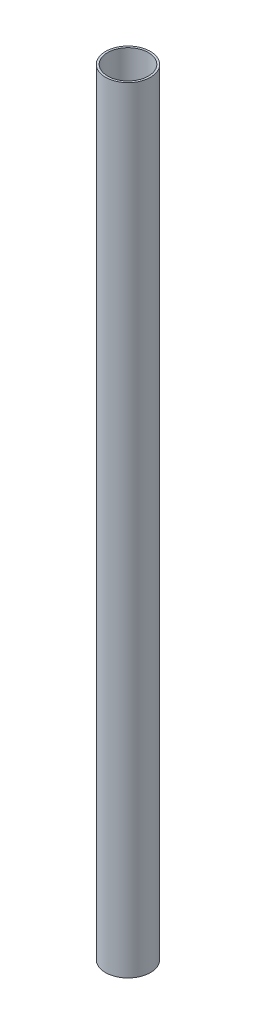
from build123d import *

# Parameters (mm, degrees)
SKETCH1_R   = 27.94
SKETCH1_R_2 = 25.4


with BuildPart() as part:
    # Sweep2: sweep along a curve in space
    with BuildLine() as sweep2_path:
        Line((0, 0, 0), (0, -965.2, 0))
    # Sketch1 → Sweep2 (sweep)
    with BuildSketch(Plane(origin=(0, 0, 0), x_dir=(1, 0, 0), z_dir=(0, 1, 0))):
        Circle(SKETCH1_R)
        Circle(SKETCH1_R_2, mode=Mode.SUBTRACT)
    sweep(path=sweep2_path.line)


solid = part.part
